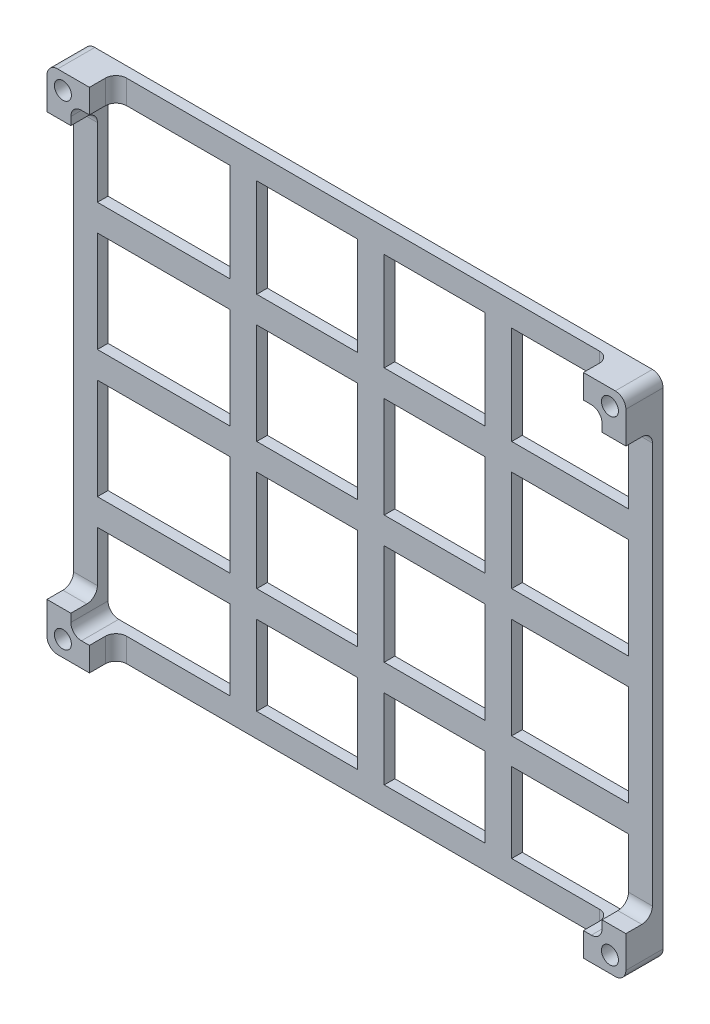
from build123d import *

# Parameters (mm, degrees)
BASE_SKETCH_R       = 1.6
BASE_SKETCH_W       = 25
BASE_SKETCH_H       = 5
BASE_SKETCH_W_2     = 5
BASE_SKETCH_H_2     = 15
BASE_SKETCH_W_3     = 19
BASE_SKETCH_W_4     = 22
BASE_SKETCH_W_5     = 4.5
BASE_SKETCH_H_3     = 11.5
BASE_SKETCH_H_4     = 19
BASE_SKETCH_H_5     = 18.5
BOSS_EXTRUDE1_DEPTH = 2
BOSS_EXTRUDE2_START = 2
SKETCH1_7_R         = 1.6
BOSS_EXTRUDE2_DEPTH = 5
FILLET1_R           = 2


with BuildPart() as part:
    # Base_Sketch → Boss-Extrude1 (new body)
    # profile 1 of 47: a face of its own
    with BuildSketch(Plane.XY):
        Polygon((-46.5, -43.25), (-46.5, -47.75), (46.5, -47.75), (46.5, -43.25), (28, -43.25), (23, -43.25), (4, -43.25), (-1, -43.25), (-20, -43.25), (-25, -43.25), align=None)
    # profile 2 of 47: a face of its own
    with BuildSketch(Plane.XY):
        Polygon((-50, -39.75), (-54.5, -39.75), (-54.5, -47.75), (-46.5, -47.75), (-46.5, -43.25), (-50, -43.25), align=None)
        with Locations((-51.5, -44.75)):
            Circle(BASE_SKETCH_R, mode=Mode.SUBTRACT)
    # profile 3 of 47: a face of its own
    with BuildSketch(Plane.XY):
        Polygon((-50, 39.75), (-54.5, 39.75), (-54.5, -39.75), (-50, -39.75), (-50, -28.25), (-50, -23.25), (-50, -4.25), (-50, 0.75), (-50, 19.75), (-50, 24.75), align=None)
    # profile 4 of 47: a face of its own
    with BuildSketch(Plane.XY):
        with Locations((-37.5, -25.75)):
            Rectangle(BASE_SKETCH_W, BASE_SKETCH_H)
    # profile 5 of 47: a face of its own
    with BuildSketch(Plane.XY):
        with Locations((-22.5, -25.75)):
            Rectangle(BASE_SKETCH_W_2, BASE_SKETCH_H)
    # profile 6 of 47: a face of its own
    with BuildSketch(Plane.XY):
        with Locations((-22.5, -35.75)):
            Rectangle(BASE_SKETCH_W_2, BASE_SKETCH_H_2)
    # profile 7 of 47: a face of its own
    with BuildSketch(Plane.XY):
        with Locations((-10.5, -25.75)):
            Rectangle(BASE_SKETCH_W_3, BASE_SKETCH_H)
    # profile 8 of 47: a face of its own
    with BuildSketch(Plane.XY):
        with Locations((1.5, -25.75)):
            Rectangle(BASE_SKETCH_W_2, BASE_SKETCH_H)
    # profile 9 of 47: a face of its own
    with BuildSketch(Plane.XY):
        with Locations((1.5, -35.75)):
            Rectangle(BASE_SKETCH_W_2, BASE_SKETCH_H_2)
    # profile 10 of 47: a face of its own
    with BuildSketch(Plane.XY):
        with Locations((13.5, -25.75)):
            Rectangle(BASE_SKETCH_W_3, BASE_SKETCH_H)
    # profile 11 of 47: a face of its own
    with BuildSketch(Plane.XY):
        with Locations((25.5, -25.75)):
            Rectangle(BASE_SKETCH_W_2, BASE_SKETCH_H)
    # profile 12 of 47: a face of its own
    with BuildSketch(Plane.XY):
        with Locations((25.5, -35.75)):
            Rectangle(BASE_SKETCH_W_2, BASE_SKETCH_H_2)
    # profile 13 of 47: a face of its own
    with BuildSketch(Plane.XY):
        with Locations((39, -25.75)):
            Rectangle(BASE_SKETCH_W_4, BASE_SKETCH_H)
    # profile 14 of 47: a face of its own
    with BuildSketch(Plane.XY):
        with Locations((52.25, -25.75)):
            Rectangle(BASE_SKETCH_W_5, BASE_SKETCH_H)
    # profile 15 of 47: a face of its own
    with BuildSketch(Plane.XY):
        with Locations((52.25, -34)):
            Rectangle(BASE_SKETCH_W_5, BASE_SKETCH_H_3)
    # profile 16 of 47: a face of its own
    with BuildSketch(Plane.XY):
        Polygon((46.5, -43.25), (46.5, -47.75), (54.5, -47.75), (54.5, -39.75), (50, -39.75), (50, -43.25), align=None)
        with Locations((51.5, -44.75)):
            Circle(BASE_SKETCH_R, mode=Mode.SUBTRACT)
    # profile 17 of 47: a face of its own
    with BuildSketch(Plane.XY):
        with Locations((52.25, -13.75)):
            Rectangle(BASE_SKETCH_W_5, BASE_SKETCH_H_4)
    # profile 18 of 47: a face of its own
    with BuildSketch(Plane.XY):
        with Locations((52.25, -1.75)):
            Rectangle(BASE_SKETCH_W_5, BASE_SKETCH_H)
    # profile 19 of 47: a face of its own
    with BuildSketch(Plane.XY):
        with Locations((39, -1.75)):
            Rectangle(BASE_SKETCH_W_4, BASE_SKETCH_H)
    # profile 20 of 47: a face of its own
    with BuildSketch(Plane.XY):
        with Locations((25.5, -1.75)):
            Rectangle(BASE_SKETCH_W_2, BASE_SKETCH_H)
    # profile 21 of 47: a face of its own
    with BuildSketch(Plane.XY):
        with Locations((25.5, -13.75)):
            Rectangle(BASE_SKETCH_W_2, BASE_SKETCH_H_4)
    # profile 22 of 47: a face of its own
    with BuildSketch(Plane.XY):
        with Locations((25.5, 10.25)):
            Rectangle(BASE_SKETCH_W_2, BASE_SKETCH_H_4)
    # profile 23 of 47: a face of its own
    with BuildSketch(Plane.XY):
        with Locations((13.5, -1.75)):
            Rectangle(BASE_SKETCH_W_3, BASE_SKETCH_H)
    # profile 24 of 47: a face of its own
    with BuildSketch(Plane.XY):
        with Locations((1.5, -1.75)):
            Rectangle(BASE_SKETCH_W_2, BASE_SKETCH_H)
    # profile 25 of 47: a face of its own
    with BuildSketch(Plane.XY):
        with Locations((1.5, -13.75)):
            Rectangle(BASE_SKETCH_W_2, BASE_SKETCH_H_4)
    # profile 26 of 47: a face of its own
    with BuildSketch(Plane.XY):
        with Locations((52.25, 10.25)):
            Rectangle(BASE_SKETCH_W_5, BASE_SKETCH_H_4)
    # profile 27 of 47: a face of its own
    with BuildSketch(Plane.XY):
        with Locations((52.25, 22.25)):
            Rectangle(BASE_SKETCH_W_5, BASE_SKETCH_H)
    # profile 28 of 47: a face of its own
    with BuildSketch(Plane.XY):
        with Locations((52.25, 32.25)):
            Rectangle(BASE_SKETCH_W_5, BASE_SKETCH_H_2)
    # profile 29 of 47: a face of its own
    with BuildSketch(Plane.XY):
        Polygon((54.5, 47.75), (46.5, 47.75), (46.5, 43.25), (50, 43.25), (50, 39.75), (54.5, 39.75), align=None)
        with Locations((51.5, 44.75)):
            Circle(BASE_SKETCH_R, mode=Mode.SUBTRACT)
    # profile 30 of 47: a face of its own
    with BuildSketch(Plane.XY):
        Polygon((46.5, 47.75), (-46.5, 47.75), (-46.5, 43.25), (-25, 43.25), (-20, 43.25), (-1, 43.25), (4, 43.25), (23, 43.25), (28, 43.25), (46.5, 43.25), align=None)
    # profile 31 of 47: a face of its own
    with BuildSketch(Plane.XY):
        with Locations((39, 22.25)):
            Rectangle(BASE_SKETCH_W_4, BASE_SKETCH_H)
    # profile 32 of 47: a face of its own
    with BuildSketch(Plane.XY):
        with Locations((25.5, 34)):
            Rectangle(BASE_SKETCH_W_2, BASE_SKETCH_H_5)
    # profile 33 of 47: a face of its own
    with BuildSketch(Plane.XY):
        with Locations((25.5, 22.25)):
            Rectangle(BASE_SKETCH_W_2, BASE_SKETCH_H)
    # profile 34 of 47: a face of its own
    with BuildSketch(Plane.XY):
        with Locations((13.5, 22.25)):
            Rectangle(BASE_SKETCH_W_3, BASE_SKETCH_H)
    # profile 35 of 47: a face of its own
    with BuildSketch(Plane.XY):
        with Locations((1.5, 22.25)):
            Rectangle(BASE_SKETCH_W_2, BASE_SKETCH_H)
    # profile 36 of 47: a face of its own
    with BuildSketch(Plane.XY):
        with Locations((1.5, 34)):
            Rectangle(BASE_SKETCH_W_2, BASE_SKETCH_H_5)
    # profile 37 of 47: a face of its own
    with BuildSketch(Plane.XY):
        with Locations((1.5, 10.25)):
            Rectangle(BASE_SKETCH_W_2, BASE_SKETCH_H_4)
    # profile 38 of 47: a face of its own
    with BuildSketch(Plane.XY):
        with Locations((-10.5, 22.25)):
            Rectangle(BASE_SKETCH_W_3, BASE_SKETCH_H)
    # profile 39 of 47: a face of its own
    with BuildSketch(Plane.XY):
        with Locations((-10.5, -1.75)):
            Rectangle(BASE_SKETCH_W_3, BASE_SKETCH_H)
    # profile 40 of 47: a face of its own
    with BuildSketch(Plane.XY):
        with Locations((-22.5, -1.75)):
            Rectangle(BASE_SKETCH_W_2, BASE_SKETCH_H)
    # profile 41 of 47: a face of its own
    with BuildSketch(Plane.XY):
        Polygon((-46.5, 47.75), (-54.5, 47.75), (-54.5, 39.75), (-50, 39.75), (-50, 43.25), (-46.5, 43.25), align=None)
        with Locations((-51.5, 44.75)):
            Circle(BASE_SKETCH_R, mode=Mode.SUBTRACT)
    # profile 42 of 47: a face of its own
    with BuildSketch(Plane.XY):
        with Locations((-37.5, 22.25)):
            Rectangle(BASE_SKETCH_W, BASE_SKETCH_H)
    # profile 43 of 47: a face of its own
    with BuildSketch(Plane.XY):
        with Locations((-22.5, 22.25)):
            Rectangle(BASE_SKETCH_W_2, BASE_SKETCH_H)
    # profile 44 of 47: a face of its own
    with BuildSketch(Plane.XY):
        with Locations((-22.5, 34)):
            Rectangle(BASE_SKETCH_W_2, BASE_SKETCH_H_5)
    # profile 45 of 47: a face of its own
    with BuildSketch(Plane.XY):
        with Locations((-22.5, 10.25)):
            Rectangle(BASE_SKETCH_W_2, BASE_SKETCH_H_4)
    # profile 46 of 47: a face of its own
    with BuildSketch(Plane.XY):
        with Locations((-37.5, -1.75)):
            Rectangle(BASE_SKETCH_W, BASE_SKETCH_H)
    # profile 47 of 47: a face of its own
    with BuildSketch(Plane.XY):
        with Locations((-22.5, -13.75)):
            Rectangle(BASE_SKETCH_W_2, BASE_SKETCH_H_4)
    extrude(amount=BOSS_EXTRUDE1_DEPTH)

    # Sketch1<7> → Boss-Extrude2 (add)
    # profile 1 of 4: a face of its own
    with BuildSketch(Plane.XY.offset(BOSS_EXTRUDE2_START)):
        Polygon((-46.5, 47.75), (-54.5, 47.75), (-54.5, 39.75), (-50, 39.75), (-50, 43.25), (-46.5, 43.25), align=None)
        with Locations((-51.5, 44.75)):
            Circle(SKETCH1_7_R, mode=Mode.SUBTRACT)
    # profile 2 of 4: a face of its own
    with BuildSketch(Plane.XY.offset(BOSS_EXTRUDE2_START)):
        Polygon((54.5, 47.75), (46.5, 47.75), (46.5, 43.25), (50, 43.25), (50, 39.75), (54.5, 39.75), align=None)
        with Locations((51.5, 44.75)):
            Circle(SKETCH1_7_R, mode=Mode.SUBTRACT)
    # profile 3 of 4: a face of its own
    with BuildSketch(Plane.XY.offset(BOSS_EXTRUDE2_START)):
        Polygon((-50, -39.75), (-54.5, -39.75), (-54.5, -47.75), (-46.5, -47.75), (-46.5, -43.25), (-50, -43.25), align=None)
        with Locations((-51.5, -44.75)):
            Circle(SKETCH1_7_R, mode=Mode.SUBTRACT)
    # profile 4 of 4: a face of its own
    with BuildSketch(Plane.XY.offset(BOSS_EXTRUDE2_START)):
        Polygon((46.5, -43.25), (46.5, -47.75), (54.5, -47.75), (54.5, -39.75), (50, -39.75), (50, -43.25), align=None)
        with Locations((51.5, -44.75)):
            Circle(SKETCH1_7_R, mode=Mode.SUBTRACT)
    extrude(amount=BOSS_EXTRUDE2_DEPTH)

    # Fillet1
    fillet1_edges = [part.edges().sort_by_distance(p)[0] for p in [
        (-50, -43.25, 3.5),
        (50, -43.25, 3.5),
        (-50, 43.25, 3.5),
        (50, 43.25, 3.5),
        (54.5, -47.75, 3.5),
        (-54.5, -47.75, 3.5),
        (-54.5, 47.75, 3.5),
        (54.5, 47.75, 3.5),
        (-46.5, 45.5, 2),
        (-52.25, 39.75, 2),
        (52.25, 39.75, 2),
        (46.5, 45.5, 2),
        (-52.25, -39.75, 2),
        (-46.5, -45.5, 2),
        (46.5, -45.5, 2),
        (52.25, -39.75, 2),
    ]]
    fillet(fillet1_edges, radius=FILLET1_R)


solid = part.part
